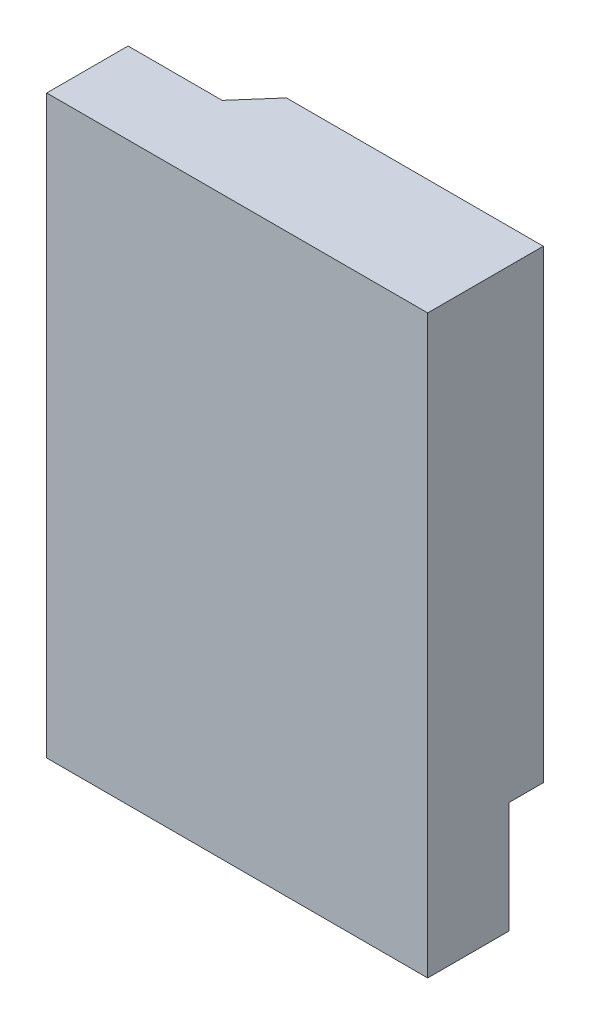
from build123d import *

# Parameters (mm, degrees)
SKETCH1_W           = 44.5
SKETCH1_H           = 67.274262182
BOSS_EXTRUDE1_DEPTH = 13.5
CUT_EXTRUDE1_DEPTH  = 73.5
CUT_EXTRUDE2_DEPTH  = 14
BOSS_EXTRUDE2_DEPTH = 14
CUT_EXTRUDE6_DEPTH  = 13
CUT_EXTRUDE8_DEPTH  = 2


with BuildPart() as part:
    # Sketch1 → Boss-Extrude1 (new body)
    with BuildSketch(Plane.XY):
        Rectangle(SKETCH1_W, SKETCH1_H)
    extrude(amount=BOSS_EXTRUDE1_DEPTH)

    # Sketch2 → Cut-Extrude1 (cut)
    with BuildSketch(Plane(origin=(0, 33.637131091, 0), x_dir=(1, 0, 0), z_dir=(0, 1, 0))):
        Polygon((-22.25, 0), (-7.75, 0), (-11.25, -4), (-22.25, -4), align=None)
    extrude(amount=-CUT_EXTRUDE1_DEPTH, mode=Mode.SUBTRACT)

    # Sketch3 → Cut-Extrude2 (cut)
    with BuildSketch(Plane.XZ.offset(33.637131091)):
        Polygon((22.25, 13.5), (8.05, 13.5), (12.5, 9.5), (22.25, 9.5), align=None)
    extrude(amount=-CUT_EXTRUDE2_DEPTH, mode=Mode.SUBTRACT)

    # Sketch6 → Boss-Extrude2 (add)
    with BuildSketch(Plane(origin=(0, -33.637131091, 0), x_dir=(-1, 0, 0), z_dir=(0, -1, 0))):
        Polygon((-22.25, -9.5), (-12.5, -9.5), (-8.05, -13.5), (-22.25, -13.5), align=None)
    extrude(amount=-BOSS_EXTRUDE2_DEPTH)

    # Sketch7 → Cut-Extrude6 (cut)
    with BuildSketch(Plane.XZ.offset(33.637131091)):
        Polygon((22.25, 0), (8.05, 0), (13.25, 4), (22.25, 4), align=None)
    extrude(amount=-CUT_EXTRUDE6_DEPTH, mode=Mode.SUBTRACT)

    # Sketch9 → Cut-Extrude8 (cut)
    # profile 1 of 10: a face of its own
    with BuildSketch(Plane(origin=(0, 0, 0), x_dir=(-1, 0, 0), z_dir=(0, 0, -1))):
        Polygon((-3.479095708, 31.090623678), (-2.896463496, 31.090623678), (-1.483001958, 27.590623678), (-2.153975515, 27.590623678), (-2.426010772, 28.308572396), (-3.950950676, 28.308572396), (-4.222985932, 27.590623678), (-4.893258368, 27.590623678), align=None)
        Polygon((-3.188130163, 30.151821595), (-3.712569265, 28.936777524), (-2.66369106, 28.936777524), align=None, mode=Mode.SUBTRACT)
    # profile 2 of 10: a face of its own
    with BuildSketch(Plane(origin=(0, 0, 0), x_dir=(-1, 0, 0), z_dir=(0, 0, -1))):
        with BuildLine():
            Line((-4.556719907, 24.391905729), (-3.824748753, 24.391905729))
            add(Edge.make_bspline(
                [(-3.824748753, 24.391905729), (-3.776365682, 24.391733997), (-3.683311409, 24.391403708), (-3.549132229, 24.386192618), (-3.4258702, 24.378940959), (-3.313342821, 24.367874735), (-3.211598233, 24.353202259), (-3.120534464, 24.335905839), (-3.040154176, 24.316192859), (-2.969779471, 24.291628931), (-2.906269781, 24.263921192), (-2.84706992, 24.232084493), (-2.790873851, 24.196473344), (-2.738057185, 24.15615072), (-2.688160932, 24.111842015), (-2.64109096, 24.063502628), (-2.597512411, 24.010722661), (-2.557695126, 23.953835616), (-2.521404875, 23.893991749), (-2.489331905, 23.831108895), (-2.463250113, 23.765143321), (-2.440204053, 23.697048375), (-2.423604723, 23.625850623), (-2.412060132, 23.55224319), (-2.403607634, 23.475966969), (-2.403121655, 23.424148291), (-2.402873753, 23.397715024)],
                knots=[0, 0, 0, 0, 1.749336639, 3.364467119, 4.854658419, 6.213483162, 7.451590619, 8.570285859, 9.5643256, 10.440900261, 11.26203566, 12.067320669, 12.869050712, 13.665104639, 14.467235401, 15.27997916, 16.102287765, 16.939272006, 17.78853747, 18.631303466, 19.488103222, 20.351255419, 21.228522269, 22.127379805, 23.044756219, 24, 24, 24, 24], degree=3))
            add(Edge.make_bspline(
                [(-2.402873753, 23.397715024), (-2.403517715, 23.370124765), (-2.404780407, 23.316025297), (-2.411581956, 23.23655759), (-2.42401305, 23.160528447), (-2.442841751, 23.088160471), (-2.464482896, 23.018552958), (-2.493260069, 22.952990211), (-2.525737952, 22.890518715), (-2.564310985, 22.832022153), (-2.606643005, 22.776201198), (-2.655874253, 22.72519456), (-2.708815301, 22.676260823), (-2.768442159, 22.632465033), (-2.832126418, 22.590845874), (-2.901133418, 22.553127833), (-2.975012797, 22.518362764), (-3.026953658, 22.49897536), (-3.053514778, 22.489061178)],
                knots=[0, 0, 0, 0, 1.099860209, 2.156625411, 3.176576793, 4.16617041, 5.135385252, 6.078461593, 7.016046972, 7.938469504, 8.868247731, 9.803980173, 10.76021508, 11.73834243, 12.748633912, 13.790971185, 14.870363756, 16, 16, 16, 16], degree=3))
            Line((-3.053514778, 22.489061178), (-2.245822471, 20.891905729))
            Line((-2.245822471, 20.891905729), (-2.944139778, 20.891905729))
            Line((-2.944139778, 20.891905729), (-3.715373753, 22.417546755))
            Line((-3.715373753, 22.417546755), (-3.928514778, 22.417546755))
            Line((-3.928514778, 22.417546755), (-3.928514778, 20.891905729))
            Line((-3.928514778, 20.891905729), (-4.556719907, 20.891905729))
            Line((-4.556719907, 20.891905729), (-4.556719907, 24.391905729))
        make_face()
        with BuildLine():
            Line((-3.928514778, 23.045751883), (-3.683823272, 23.045751883))
            add(Edge.make_bspline(
                [(-3.683823272, 23.045751883), (-3.653907701, 23.046088812), (-3.596625811, 23.046733959), (-3.514246931, 23.049726419), (-3.43942726, 23.056936769), (-3.3718455, 23.066046776), (-3.311161584, 23.076565595), (-3.257916792, 23.091639701), (-3.211290702, 23.107791988), (-3.171835836, 23.12786509), (-3.138126506, 23.15069256), (-3.109020656, 23.176625135), (-3.084945945, 23.206638787), (-3.06513123, 23.239917876), (-3.049717536, 23.276756748), (-3.03846672, 23.316750994), (-3.032179178, 23.360356201), (-3.031455775, 23.390449731), (-3.031078881, 23.406128486)],
                knots=[0, 0, 0, 0, 1.688639943, 3.233382647, 4.650958383, 5.928841754, 7.082724185, 8.122798841, 9.049171256, 9.863274652, 10.613301712, 11.341792392, 12.054588806, 12.776240173, 13.521029143, 14.301969904, 15.115324896, 16, 16, 16, 16], degree=3))
            add(Edge.make_bspline(
                [(-3.031078881, 23.406128486), (-3.031791433, 23.424677597), (-3.033191109, 23.461113888), (-3.047080247, 23.513569372), (-3.069188753, 23.562120511), (-3.099493461, 23.606547939), (-3.1376583, 23.64549609), (-3.181455463, 23.679829195), (-3.2318302, 23.706977245), (-3.278473416, 23.72488381), (-3.32090784, 23.735597493), (-3.359203569, 23.743581234), (-3.403550254, 23.749239541), (-3.453981373, 23.755241182), (-3.510368377, 23.759132943), (-3.573018609, 23.761973153), (-3.641752136, 23.763135222), (-3.689665933, 23.763506715), (-3.714672631, 23.763700601)],
                knots=[0, 0, 0, 0, 1.020303359, 2.004196876, 2.966617323, 3.9489082, 4.950758222, 5.960522915, 7.003732012, 8.091992268, 8.70421221, 9.413913587, 10.24622431, 11.166358409, 12.212345909, 13.359657661, 14.621978493, 16, 16, 16, 16], degree=3))
            Line((-3.714672631, 23.763700601), (-3.928514778, 23.763700601))
            Line((-3.928514778, 23.763700601), (-3.928514778, 23.045751883))
        make_face(mode=Mode.SUBTRACT)
    # profile 3 of 10: a face of its own
    with BuildSketch(Plane(origin=(0, 0, 0), x_dir=(-1, 0, 0), z_dir=(0, 0, -1))):
        with BuildLine():
            Line((-4.556719907, 17.69318778), (-3.7651534, 17.69318778))
            add(Edge.make_bspline(
                [(-3.7651534, 17.69318778), (-3.703441686, 17.692756394), (-3.584152246, 17.69192252), (-3.411325446, 17.682526766), (-3.250618515, 17.668076762), (-3.101927857, 17.648198163), (-2.965558313, 17.621893333), (-2.841685729, 17.588899079), (-2.729894358, 17.550812702), (-2.628958431, 17.505996351), (-2.536813637, 17.453744937), (-2.449319215, 17.395541056), (-2.366646958, 17.329252531), (-2.287636691, 17.256158199), (-2.213308058, 17.174920821), (-2.142423221, 17.086885984), (-2.076717763, 16.990777061), (-2.01420555, 16.88889844), (-1.957671572, 16.780818369), (-1.908360523, 16.667456805), (-1.867052359, 16.549543269), (-1.833487337, 16.426952099), (-1.80673214, 16.300090257), (-1.788012068, 16.168701751), (-1.776439133, 16.032908222), (-1.775265155, 15.940874281), (-1.774668624, 15.894109255)],
                knots=[0, 0, 0, 0, 1.44355588, 2.790409838, 4.047694926, 5.217575253, 6.298404546, 7.294384826, 8.214239204, 9.058592145, 9.873746385, 10.689560431, 11.514393297, 12.350027578, 13.205127629, 14.088021785, 14.991911688, 15.926770944, 16.882954281, 17.842803888, 18.816321264, 19.80318086, 20.814351908, 21.847355356, 22.906180909, 24, 24, 24, 24], degree=3))
            add(Edge.make_bspline(
                [(-1.774668624, 15.894109255), (-1.776230664, 15.828120759), (-1.779305631, 15.698218543), (-1.805207435, 15.507588538), (-1.847099422, 15.324850664), (-1.90600336, 15.15143437), (-1.979028475, 14.988883951), (-2.066265152, 14.840065917), (-2.166434299, 14.705779048), (-2.278368938, 14.586691982), (-2.399566891, 14.484335034), (-2.525516004, 14.3966738), (-2.65744325, 14.327545601), (-2.773689592, 14.283707986), (-2.874489673, 14.256444782), (-2.962991053, 14.240331966), (-3.063519591, 14.225555542), (-3.177012628, 14.214136639), (-3.302972294, 14.203953784), (-3.441900667, 14.198420817), (-3.593347936, 14.193823742), (-3.698542384, 14.193405322), (-3.75323433, 14.19318778)],
                knots=[0, 0, 0, 0, 1.315458931, 2.589557908, 3.828601765, 5.048913369, 6.235739168, 7.376350998, 8.481830359, 9.569842114, 10.627874879, 11.640079404, 12.624025415, 13.590060155, 14.111227486, 14.704434459, 15.382649715, 16.137166398, 16.978595427, 17.902333227, 18.909396075, 20, 20, 20, 20], degree=3))
            Line((-3.75323433, 14.19318778), (-4.556719907, 14.19318778))
            Line((-4.556719907, 14.19318778), (-4.556719907, 17.69318778))
        make_face()
        with BuildLine():
            Line((-3.928514778, 17.064982652), (-3.928514778, 14.821392909))
            Line((-3.928514778, 14.821392909), (-3.600389778, 14.821392909))
            add(Edge.make_bspline(
                [(-3.600389778, 14.821392909), (-3.561347943, 14.82146445), (-3.486257495, 14.821602046), (-3.377843887, 14.8281559), (-3.277588788, 14.834734162), (-3.185768178, 14.847219923), (-3.101713815, 14.861128182), (-3.026580385, 14.880483429), (-2.958819062, 14.900814477), (-2.899257538, 14.92669842), (-2.844704035, 14.955832521), (-2.794193722, 14.989966497), (-2.745437129, 15.027870991), (-2.699345798, 15.070660827), (-2.655745286, 15.117769387), (-2.614893561, 15.169439401), (-2.576245359, 15.225513222), (-2.540792709, 15.286287327), (-2.508395886, 15.351119926), (-2.479656275, 15.419383023), (-2.455826896, 15.491645101), (-2.436021375, 15.5672297), (-2.421868085, 15.64679487), (-2.410158937, 15.729751283), (-2.404122529, 15.816427606), (-2.40329407, 15.875405073), (-2.402873753, 15.905327204)],
                knots=[0, 0, 0, 0, 1.50275155, 2.890291501, 4.180787663, 5.369391935, 6.45668281, 7.458360028, 8.354766181, 9.177074746, 9.954075863, 10.732690366, 11.5210699, 12.329727389, 13.151100085, 13.990027547, 14.863562427, 15.770965086, 16.696477834, 17.652329173, 18.619756807, 19.62365428, 20.657822005, 21.729286259, 22.847956731, 24, 24, 24, 24], degree=3))
            add(Edge.make_bspline(
                [(-2.402873753, 15.905327204), (-2.403710883, 15.95118004), (-2.405343221, 16.040589519), (-2.42108514, 16.170816377), (-2.446709982, 16.293444472), (-2.483274161, 16.408018699), (-2.529364443, 16.514861072), (-2.587057175, 16.613066409), (-2.653869483, 16.704284426), (-2.706702834, 16.757795841), (-2.733102118, 16.784533934)],
                knots=[0, 0, 0, 0, 1.13821349, 2.219428113, 3.251817212, 4.244760574, 5.201143372, 6.134805572, 7.068016741, 8, 8, 8, 8], degree=3))
            add(Edge.make_bspline(
                [(-2.733102118, 16.784533934), (-2.759134312, 16.807318405), (-2.812302121, 16.853853105), (-2.905647322, 16.909613577), (-3.008508898, 16.958604618), (-3.123240015, 16.997449049), (-3.248731848, 17.028168881), (-3.385731827, 17.049355598), (-3.533506289, 17.062969958), (-3.635880993, 17.064297381), (-3.688731124, 17.064982652)],
                knots=[0, 0, 0, 0, 0.813307809, 1.661089106, 2.549956539, 3.493439533, 4.508053171, 5.589449661, 6.755572447, 8, 8, 8, 8], degree=3))
            Line((-3.688731124, 17.064982652), (-3.928514778, 17.064982652))
        make_face(mode=Mode.SUBTRACT)
    # profile 4 of 10: a face of its own
    with BuildSketch(Plane(origin=(0, 0, 0), x_dir=(-1, 0, 0), z_dir=(0, 0, -1))):
        with BuildLine():
            Line((-4.556719907, 10.994469832), (-3.928514778, 10.994469832))
            Line((-3.928514778, 10.994469832), (-3.928514778, 8.717226242))
            add(Edge.make_bspline(
                [(-3.928514778, 8.717226242), (-3.92848062, 8.693616768), (-3.928414642, 8.648015313), (-3.925111791, 8.582592156), (-3.922089454, 8.522454576), (-3.9166363, 8.467668412), (-3.908580124, 8.418210227), (-3.900779116, 8.37376232), (-3.890221223, 8.335120481), (-3.874354397, 8.291135951), (-3.849908829, 8.24171693), (-3.809966125, 8.190211292), (-3.763875663, 8.143204922), (-3.708633589, 8.1040786), (-3.646546383, 8.072428933), (-3.577955187, 8.048980031), (-3.50295669, 8.035945556), (-3.451099343, 8.033955604), (-3.424408208, 8.03293137)],
                knots=[0, 0, 0, 0, 1.155499968, 2.231836252, 3.205919964, 4.102923608, 4.924856345, 5.658536265, 6.31071849, 6.882491295, 7.94666036, 8.992281882, 10.060072772, 11.158554251, 12.289267114, 13.461410017, 14.693379945, 16, 16, 16, 16], degree=3))
            add(Edge.make_bspline(
                [(-3.424408208, 8.03293137), (-3.39605217, 8.03375882), (-3.340762698, 8.035372207), (-3.261237593, 8.051209345), (-3.187557133, 8.076427492), (-3.121281384, 8.112420216), (-3.0624763, 8.155563803), (-3.01269903, 8.204761012), (-2.97341499, 8.260109967), (-2.947811115, 8.311173592), (-2.9334358, 8.358173213), (-2.922660785, 8.400165591), (-2.914761507, 8.44971244), (-2.907595023, 8.50603998), (-2.903288517, 8.569731654), (-2.898618815, 8.640275248), (-2.896907325, 8.718153438), (-2.896615614, 8.772381483), (-2.896463496, 8.800659736)],
                knots=[0, 0, 0, 0, 1.261321664, 2.459363699, 3.594844139, 4.716940403, 5.803436589, 6.833651888, 7.818396249, 8.814403945, 9.360733334, 10.004355033, 10.743453831, 11.592799886, 12.532235708, 13.585170094, 14.740740724, 16, 16, 16, 16], degree=3))
            Line((-2.896463496, 8.800659736), (-2.896463496, 10.994469832))
            Line((-2.896463496, 10.994469832), (-2.268258368, 10.994469832))
            Line((-2.268258368, 10.994469832), (-2.268258368, 8.906529127))
            add(Edge.make_bspline(
                [(-2.268258368, 8.906529127), (-2.268345606, 8.864227548), (-2.268513355, 8.782885737), (-2.271089483, 8.665991831), (-2.276573594, 8.559227998), (-2.281179614, 8.462563043), (-2.29009384, 8.376127189), (-2.299380373, 8.29955133), (-2.311216858, 8.233106834), (-2.328828836, 8.15746785), (-2.359221896, 8.070372329), (-2.408219493, 7.970085614), (-2.470418772, 7.871898844), (-2.54393521, 7.776892143), (-2.626941994, 7.68863398), (-2.717598685, 7.611154737), (-2.814464974, 7.545615651), (-2.918553044, 7.493619234), (-3.029774311, 7.453065949), (-3.149229226, 7.425816183), (-3.276836331, 7.4074059), (-3.36497697, 7.405637366), (-3.410385772, 7.404726242)],
                knots=[0, 0, 0, 0, 1.170808336, 2.251350247, 3.235597562, 4.129743112, 4.929140599, 5.639994148, 6.264258765, 6.79612947, 7.788252245, 8.809469599, 9.879094798, 10.999557536, 12.129761673, 13.226370002, 14.293821979, 15.358369427, 16.438775801, 17.562147481, 18.744053101, 20, 20, 20, 20], degree=3))
            add(Edge.make_bspline(
                [(-3.410385772, 7.404726242), (-3.440556283, 7.405234424), (-3.500082083, 7.406237058), (-3.587625215, 7.415077666), (-3.672252848, 7.428105399), (-3.753805969, 7.447111519), (-3.832567633, 7.471663876), (-3.908516914, 7.501886118), (-3.981371567, 7.537609669), (-4.050723907, 7.57850595), (-4.116488591, 7.622728237), (-4.176594117, 7.671750503), (-4.233108858, 7.721947368), (-4.284400127, 7.775431328), (-4.330853166, 7.831640892), (-4.372372305, 7.890703451), (-4.408895861, 7.952613758), (-4.441342564, 8.018487741), (-4.469113775, 8.09167354), (-4.49252595, 8.174774401), (-4.512979376, 8.269092849), (-4.528179156, 8.374841377), (-4.541959365, 8.491671451), (-4.550681478, 8.619887431), (-4.555244408, 8.759492994), (-4.556215646, 8.856278637), (-4.556719907, 8.906529127)],
                knots=[0, 0, 0, 0, 1.001158378, 1.975264943, 2.917723546, 3.841610987, 4.75185031, 5.653588123, 6.552117133, 7.442167995, 8.324307438, 9.179605724, 10.014504199, 10.831958861, 11.636465792, 12.43274043, 13.225645099, 14.020104002, 14.867201867, 15.819789774, 16.883317127, 18.068162734, 19.364263498, 20.787406516, 22.332041935, 24, 24, 24, 24], degree=3))
            Line((-4.556719907, 8.906529127), (-4.556719907, 10.994469832))
        make_face()
    # profile 5 of 10: a face of its own
    with BuildSketch(Plane(origin=(0, 0, 0), x_dir=(-1, 0, 0), z_dir=(0, 0, -1))):
        with BuildLine():
            Line((-1.415694265, 3.688580409), (-1.876331285, 3.248275922))
            add(Edge.make_bspline(
                [(-1.876331285, 3.248275922), (-1.915406269, 3.288679521), (-1.991731956, 3.367600409), (-2.114721361, 3.47208471), (-2.242625864, 3.559158238), (-2.372957339, 3.632491008), (-2.50806007, 3.687972476), (-2.646371902, 3.728402755), (-2.788775997, 3.753051569), (-2.885149612, 3.755871829), (-2.933622951, 3.757290345)],
                knots=[0, 0, 0, 0, 1.115251505, 2.178435587, 3.19620269, 4.182487026, 5.141301733, 6.088180966, 7.038406374, 8, 8, 8, 8], degree=3))
            add(Edge.make_bspline(
                [(-2.933622951, 3.757290345), (-2.974104081, 3.756169668), (-3.053989129, 3.753958136), (-3.171281314, 3.737745426), (-3.283477351, 3.710175007), (-3.390961304, 3.672177862), (-3.493416898, 3.623011573), (-3.591058942, 3.562714194), (-3.683646706, 3.491830296), (-3.769957158, 3.410726635), (-3.848910926, 3.322114791), (-3.918671608, 3.227566164), (-3.977107369, 3.127297361), (-4.025064647, 3.02232383), (-4.062421513, 2.912159701), (-4.089099009, 2.796879143), (-4.10452856, 2.676344863), (-4.106831524, 2.594406558), (-4.108001958, 2.552763101)],
                knots=[0, 0, 0, 0, 1.035432265, 2.043311493, 3.022114605, 3.98653278, 4.95457646, 5.923598177, 6.917315552, 7.932509744, 8.948865224, 9.949768934, 10.933144597, 11.912367597, 12.897413939, 13.903909035, 14.934704909, 16, 16, 16, 16], degree=3))
            add(Edge.make_bspline(
                [(-4.108001958, 2.552763101), (-4.107664652, 2.523534809), (-4.106999816, 2.465925245), (-4.099722004, 2.380704712), (-4.088003012, 2.298020647), (-4.071042727, 2.217998295), (-4.049833723, 2.140568309), (-4.024950733, 2.065062703), (-3.993735387, 1.992524795), (-3.959085883, 1.922112104), (-3.918788908, 1.85574593), (-3.875341336, 1.792460274), (-3.828229538, 1.732565358), (-3.777148367, 1.676306033), (-3.72137892, 1.624561507), (-3.662362631, 1.57577576), (-3.599103977, 1.531170065), (-3.532916999, 1.489624993), (-3.463229927, 1.453534435), (-3.391933532, 1.420843362), (-3.317946818, 1.39429335), (-3.242170616, 1.372891618), (-3.164875724, 1.354692642), (-3.085306127, 1.343486973), (-3.004151593, 1.335001051), (-2.94930475, 1.334477095), (-2.921703881, 1.334213422)],
                knots=[0, 0, 0, 0, 1.103660481, 2.175337485, 3.227646561, 4.255952547, 5.262355991, 6.258840057, 7.255597736, 8.242457506, 9.22035537, 10.185017736, 11.140346927, 12.096287581, 13.051739095, 14.01125915, 14.986044842, 15.97314143, 16.960198552, 17.947847494, 18.933482797, 19.925264591, 20.920966487, 21.929612487, 22.958107872, 24, 24, 24, 24], degree=3))
            add(Edge.make_bspline(
                [(-2.921703881, 1.334213422), (-2.874888064, 1.335567583), (-2.782907158, 1.338228159), (-2.647911952, 1.359033486), (-2.51927497, 1.393257072), (-2.416494636, 1.433673138), (-2.33596896, 1.473584528), (-2.274665953, 1.510500598), (-2.211273866, 1.551795276), (-2.146845587, 1.599027067), (-2.080656426, 1.65162917), (-2.013874774, 1.710753671), (-1.944791009, 1.774453685), (-1.89953492, 1.819917635), (-1.876331285, 1.843227845)],
                knots=[0, 0, 0, 0, 1.404581149, 2.759636711, 4.088442092, 5.392261763, 6.066678138, 6.783632037, 7.538459478, 8.336747902, 9.180226004, 10.074962426, 11.012997595, 12, 12, 12, 12], degree=3))
            Line((-1.876331285, 1.843227845), (-1.429716701, 1.374177364))
            add(Edge.make_bspline(
                [(-1.429716701, 1.374177364), (-1.461111303, 1.343866862), (-1.52238685, 1.284707244), (-1.614819313, 1.200706108), (-1.707135446, 1.125221748), (-1.797105083, 1.055514415), (-1.886202022, 0.993614852), (-1.974416813, 0.939461238), (-2.060750827, 0.891683951), (-2.146996816, 0.851088732), (-2.233691449, 0.816619174), (-2.322890038, 0.786943148), (-2.414865272, 0.761838297), (-2.510178893, 0.741581979), (-2.607941875, 0.725339147), (-2.709069149, 0.71437533), (-2.812919517, 0.70700472), (-2.883362831, 0.706342409), (-2.918899394, 0.706008293)],
                knots=[0, 0, 0, 0, 1.244526981, 2.429050516, 3.560637417, 4.644440555, 5.67424972, 6.652764056, 7.595344123, 8.486817594, 9.369275933, 10.254498637, 11.166417451, 12.086725134, 13.032340136, 13.991389299, 14.986715468, 16, 16, 16, 16], degree=3))
            add(Edge.make_bspline(
                [(-2.918899394, 0.706008293), (-2.984175658, 0.707672315), (-3.111903162, 0.710928344), (-3.299084488, 0.735053313), (-3.476901724, 0.775498398), (-3.645787465, 0.832698905), (-3.805688009, 0.905769871), (-3.956562449, 0.995351444), (-4.098167609, 1.10120562), (-4.229359599, 1.222091686), (-4.348028996, 1.355600197), (-4.452919001, 1.498951711), (-4.539684018, 1.652850749), (-4.61172688, 1.815023729), (-4.668063451, 1.986210711), (-4.707714846, 2.166596865), (-4.732167573, 2.35600802), (-4.734842736, 2.485380204), (-4.736207086, 2.551360857)],
                knots=[0, 0, 0, 0, 1.078019885, 2.10938526, 3.111377082, 4.085535484, 5.04941344, 6.010039228, 6.978205633, 7.964457913, 8.951525778, 9.924444315, 10.892603023, 11.863865945, 12.85144698, 13.863884204, 14.910567087, 16, 16, 16, 16], degree=3))
            add(Edge.make_bspline(
                [(-4.736207086, 2.551360857), (-4.735630578, 2.594392877), (-4.734488079, 2.679671821), (-4.722480312, 2.805294616), (-4.705740786, 2.92775437), (-4.67918505, 3.045779546), (-4.64717473, 3.16096016), (-4.607365691, 3.272044334), (-4.559821513, 3.379351334), (-4.506074659, 3.4830608), (-4.44527138, 3.582493323), (-4.377347443, 3.67679462), (-4.304051474, 3.766692682), (-4.223622291, 3.850994842), (-4.137228635, 3.93044129), (-4.044480449, 4.004601491), (-3.945935566, 4.074538986), (-3.841327263, 4.138450256), (-3.7326878, 4.196261397), (-3.621387406, 4.247253293), (-3.507699534, 4.289870774), (-3.392104866, 4.325220404), (-3.274115016, 4.351606402), (-3.154572166, 4.371579752), (-3.03245915, 4.382744982), (-2.950470838, 4.384572802), (-2.909083689, 4.385495473)],
                knots=[0, 0, 0, 0, 1.071919942, 2.124283339, 3.142214191, 4.149696895, 5.136002878, 6.119640489, 7.086990633, 8.058538607, 9.028339693, 9.988281803, 10.952401235, 11.916291999, 12.888973767, 13.874849856, 14.873389453, 15.898127285, 16.927174885, 17.938320013, 18.946391617, 19.950418109, 20.947802303, 21.956882652, 22.968648068, 24, 24, 24, 24], degree=3))
            add(Edge.make_bspline(
                [(-2.909083689, 4.385495473), (-2.873776206, 4.384966575), (-2.803528341, 4.383914278), (-2.698917482, 4.375142237), (-2.595143252, 4.361365836), (-2.492577194, 4.340580181), (-2.390485651, 4.315904982), (-2.29021022, 4.283596212), (-2.190169002, 4.247582), (-2.091930996, 4.204534362), (-1.995359074, 4.157543978), (-1.902715587, 4.10423168), (-1.812445059, 4.047878248), (-1.726547831, 3.985148439), (-1.643414862, 3.91831758), (-1.563480862, 3.847073868), (-1.4874473, 3.770229459), (-1.439732857, 3.715934349), (-1.415694265, 3.688580409)],
                knots=[0, 0, 0, 0, 0.996412454, 1.982464992, 2.961075852, 3.949442424, 4.934965278, 5.923860011, 6.921385422, 7.934793307, 8.949617135, 9.951082467, 10.950285876, 11.951772932, 12.951063433, 13.960125323, 14.972308753, 16, 16, 16, 16], degree=3))
        make_face()
    # profile 6 of 10: a face of its own
    with BuildSketch(Plane(origin=(0, 0, 0), x_dir=(-1, 0, 0), z_dir=(0, 0, -1))):
        with BuildLine():
            add(Edge.make_bspline(
                [(-2.911888176, -2.313222476), (-2.851036386, -2.314798038), (-2.730901171, -2.317908554), (-2.554225622, -2.343837131), (-2.383966063, -2.38608403), (-2.220199486, -2.444810276), (-2.063335942, -2.521606474), (-1.912822122, -2.614295401), (-1.76919716, -2.724626504), (-1.633932807, -2.850025943), (-1.50892415, -2.986392356), (-1.400604076, -3.133215044), (-1.30823269, -3.286689684), (-1.231675039, -3.447227514), (-1.173362138, -3.615940337), (-1.132441563, -3.791967939), (-1.106152121, -3.975260243), (-1.10312843, -4.100057319), (-1.101591701, -4.163482893)],
                knots=[0, 0, 0, 0, 1.014329547, 2.002516266, 2.970391464, 3.935626869, 4.897733899, 5.877609409, 6.878433252, 7.912639331, 8.949961323, 9.958554974, 10.949718813, 11.932905612, 12.9188844, 13.919928257, 14.942845884, 16, 16, 16, 16], degree=3))
            add(Edge.make_bspline(
                [(-1.101591701, -4.163482893), (-1.103228251, -4.226193806), (-1.106453125, -4.349767673), (-1.131368313, -4.531370866), (-1.172977995, -4.705512846), (-1.230301864, -4.872587788), (-1.305471049, -5.031786436), (-1.396041092, -5.184125254), (-1.504401964, -5.328190499), (-1.626601318, -5.463904862), (-1.761132203, -5.587094767), (-1.903621766, -5.695655659), (-2.053412079, -5.787646061), (-2.210283897, -5.863023839), (-2.374573623, -5.921521756), (-2.545875443, -5.962796287), (-2.724178756, -5.987879653), (-2.845433655, -5.991083463), (-2.906980323, -5.992709655)],
                knots=[0, 0, 0, 0, 1.051557043, 2.072126891, 3.067553643, 4.050577992, 5.02905126, 6.015227836, 7.017913613, 8.04756643, 9.074058332, 10.072836633, 11.047628519, 12.017157415, 12.98668631, 13.966869689, 14.968021931, 16, 16, 16, 16], degree=3))
            add(Edge.make_bspline(
                [(-2.906980323, -5.992709655), (-2.971350758, -5.991250881), (-3.097829865, -5.988384587), (-3.282932604, -5.961127448), (-3.460277022, -5.920068675), (-3.628373324, -5.858790658), (-3.788933427, -5.782187984), (-3.940777649, -5.687847199), (-4.08385496, -5.575924208), (-4.217344646, -5.4492854), (-4.338286624, -5.310714768), (-4.445041643, -5.164327183), (-4.535091869, -5.011240919), (-4.608440598, -4.851384327), (-4.66626579, -4.685750877), (-4.707054892, -4.513331813), (-4.731149989, -4.33454066), (-4.734506296, -4.213102135), (-4.736207086, -4.151563822)],
                knots=[0, 0, 0, 0, 1.067978421, 2.098431617, 3.099715153, 4.085208694, 5.062210972, 6.048429807, 7.046490867, 8.072918869, 9.098532598, 10.095778865, 11.076610158, 12.041847152, 13.011192615, 13.984257998, 14.978533688, 16, 16, 16, 16], degree=3))
            add(Edge.make_bspline(
                [(-4.736207086, -4.151563822), (-4.73567328, -4.110164067), (-4.734612427, -4.027888771), (-4.721833338, -3.905960984), (-4.703435124, -3.786413063), (-4.676225038, -3.669721648), (-4.643171739, -3.555063535), (-4.60034652, -3.443505991), (-4.551599831, -3.333857274), (-4.494643916, -3.227412473), (-4.431314444, -3.125150968), (-4.362216353, -3.027555146), (-4.287175895, -2.935805082), (-4.206434801, -2.849297833), (-4.119714825, -2.768602017), (-4.028156681, -2.692575273), (-3.929984672, -2.623237141), (-3.827347476, -2.558894246), (-3.720823738, -2.500710081), (-3.610847106, -2.45118546), (-3.499683316, -2.407936453), (-3.38584737, -2.373802424), (-3.270559222, -2.346000614), (-3.152587252, -2.3276148), (-3.03299727, -2.314836065), (-2.952353679, -2.313761615), (-2.911888176, -2.313222476)],
                knots=[0, 0, 0, 0, 1.034744296, 2.056386356, 3.06226378, 4.057406941, 5.050368692, 6.043467995, 7.042652155, 8.049140477, 9.059438543, 10.048523776, 11.036952808, 12.020949711, 13.004946614, 13.997082645, 14.994316842, 16.007702937, 17.024872941, 18.026463647, 19.021641123, 20.005082605, 20.995858141, 21.984425357, 22.988620895, 24, 24, 24, 24], degree=3))
        make_face()
        with BuildLine():
            add(Edge.make_bspline(
                [(-2.921703881, -2.941427604), (-2.962657127, -2.942526472), (-3.043482447, -2.944695196), (-3.162038472, -2.961217946), (-3.275856443, -2.987606656), (-3.384305422, -3.025830379), (-3.487855435, -3.074479478), (-3.586690046, -3.133383965), (-3.6794406, -3.204568619), (-3.767343834, -3.28421185), (-3.846749941, -3.372952714), (-3.916907742, -3.468053641), (-3.975618521, -3.569355814), (-4.024789167, -3.675918162), (-4.061803765, -3.788938948), (-4.088168154, -3.907532868), (-4.104829463, -4.031904267), (-4.106929642, -4.116688088), (-4.108001958, -4.159977284)],
                knots=[0, 0, 0, 0, 1.033739768, 2.040188636, 3.016340934, 3.979330865, 4.937572243, 5.900995986, 6.878200029, 7.884839167, 8.891893314, 9.879764717, 10.863503415, 11.843163062, 12.837761627, 13.859916423, 14.907309254, 16, 16, 16, 16], degree=3))
            add(Edge.make_bspline(
                [(-4.108001958, -4.159977284), (-4.10658023, -4.20795145), (-4.10379388, -4.301972867), (-4.084188783, -4.439128777), (-4.050646413, -4.568658922), (-4.002211883, -4.689929788), (-3.942140359, -4.804287998), (-3.867541059, -4.910331929), (-3.779622141, -5.008696524), (-3.711890118, -5.066125871), (-3.677513176, -5.095273758)],
                knots=[0, 0, 0, 0, 1.078454662, 2.113592447, 3.107694534, 4.079536787, 5.043276885, 6.005368276, 6.987637804, 8, 8, 8, 8], degree=3))
            add(Edge.make_bspline(
                [(-3.677513176, -5.095273758), (-3.649351897, -5.116807097), (-3.593663819, -5.159388627), (-3.504773521, -5.213965591), (-3.413234017, -5.260743495), (-3.318354528, -5.298539487), (-3.220335433, -5.32826918), (-3.119190175, -5.349088394), (-3.015062066, -5.362154252), (-2.94464576, -5.36371587), (-2.909083689, -5.364504527)],
                knots=[0, 0, 0, 0, 1.023928204, 2.024787132, 3.009472467, 3.9914905, 4.972207045, 5.96565515, 6.972602802, 8, 8, 8, 8], degree=3))
            add(Edge.make_bspline(
                [(-2.909083689, -5.364504527), (-2.868834634, -5.363396342), (-2.789643354, -5.361215954), (-2.673294314, -5.344896608), (-2.561828399, -5.317278383), (-2.45455362, -5.279389972), (-2.35177931, -5.230130042), (-2.254007755, -5.169398522), (-2.161067534, -5.097941116), (-2.073276288, -5.017251994), (-1.993030938, -4.928161553), (-1.923019542, -4.832553368), (-1.862442053, -4.732533972), (-1.814293912, -4.626687744), (-1.775816951, -4.516013821), (-1.749769871, -4.400022053), (-1.732967812, -4.279190603), (-1.730867041, -4.19696053), (-1.72979683, -4.155069431)],
                knots=[0, 0, 0, 0, 1.026359118, 2.019393844, 2.989460624, 3.950973911, 4.916101784, 5.890408035, 6.881132271, 7.902007068, 8.92769091, 9.933912415, 10.920395702, 11.90457117, 12.894218921, 13.903490204, 14.931958862, 16, 16, 16, 16], degree=3))
            add(Edge.make_bspline(
                [(-1.72979683, -4.155069431), (-1.730904071, -4.113419217), (-1.733083506, -4.031437123), (-1.749431575, -3.910916329), (-1.776874652, -3.795436631), (-1.814876838, -3.684809438), (-1.863403618, -3.578926295), (-1.923411903, -3.478159549), (-1.994691133, -3.382606617), (-2.075600821, -3.292918656), (-2.163666043, -3.210501164), (-2.258212859, -3.138977764), (-2.356595741, -3.076826203), (-2.461072075, -3.028139179), (-2.56950436, -2.989350331), (-2.682554257, -2.960785667), (-2.80064995, -2.94481127), (-2.880992891, -2.942565546), (-2.921703881, -2.941427604)],
                knots=[0, 0, 0, 0, 1.055025985, 2.07665775, 3.074803781, 4.057872707, 5.035505728, 6.020516407, 7.023567878, 8.050795229, 9.077271434, 10.074415901, 11.050397877, 12.019801805, 12.988065821, 13.964604439, 14.968634123, 16, 16, 16, 16], degree=3))
        make_face(mode=Mode.SUBTRACT)
    # profile 7 of 10: a face of its own
    with BuildSketch(Plane(origin=(0, 0, 0), x_dir=(-1, 0, 0), z_dir=(0, 0, -1))):
        with BuildLine():
            Line((-4.556719907, -9.101684014), (-3.855598112, -9.101684014))
            add(Edge.make_bspline(
                [(-3.855598112, -9.101684014), (-3.809787723, -9.101889071), (-3.721409881, -9.102284669), (-3.593961762, -9.107081822), (-3.476384632, -9.115678611), (-3.368705504, -9.126302883), (-3.270968653, -9.141197699), (-3.183051684, -9.158273439), (-3.104936351, -9.17907666), (-3.035741788, -9.203769796), (-2.973641902, -9.232882038), (-2.914875382, -9.263888653), (-2.860770356, -9.300893955), (-2.80859598, -9.33990967), (-2.761335154, -9.384662953), (-2.716039465, -9.432175408), (-2.674627307, -9.484331341), (-2.636906794, -9.540499418), (-2.602688475, -9.599641892), (-2.572793063, -9.661864494), (-2.548543579, -9.727265684), (-2.528201278, -9.795422391), (-2.511862143, -9.866331644), (-2.500986294, -9.940429541), (-2.493598871, -10.017198703), (-2.492947033, -10.069447843), (-2.492617342, -10.09587472)],
                knots=[0, 0, 0, 0, 1.698747864, 3.27724071, 4.728299578, 6.070144658, 7.288476769, 8.393259625, 9.389771311, 10.283485332, 11.113357557, 11.931608583, 12.74405601, 13.541433047, 14.344816069, 15.154114104, 15.974336324, 16.810834471, 17.661136416, 18.50621059, 19.367396281, 20.244825668, 21.142564693, 22.063065223, 23.020325768, 24, 24, 24, 24], degree=3))
            add(Edge.make_bspline(
                [(-2.492617342, -10.09587472), (-2.493094363, -10.125110144), (-2.494031768, -10.182561345), (-2.503221354, -10.266777758), (-2.518920071, -10.347070482), (-2.539437473, -10.424116642), (-2.568047531, -10.496648656), (-2.600733178, -10.566397161), (-2.640946892, -10.631406624), (-2.686897489, -10.692490233), (-2.737080783, -10.750144627), (-2.792688123, -10.802705146), (-2.85265961, -10.850530092), (-2.91664809, -10.894120674), (-2.984893795, -10.93338896), (-3.057347483, -10.968702657), (-3.134503908, -10.998932323), (-3.188233321, -11.014742193), (-3.215473913, -11.022757732)],
                knots=[0, 0, 0, 0, 1.102006807, 2.165578795, 3.188629044, 4.184801286, 5.166646146, 6.124351954, 7.085497154, 8.042432466, 9.003981491, 9.963833307, 10.922997304, 11.89326795, 12.880200226, 13.889073926, 14.929769137, 16, 16, 16, 16], degree=3))
            add(Edge.make_bspline(
                [(-3.215473913, -11.022757732), (-3.233416134, -11.027221786), (-3.272284762, -11.036892364), (-3.336601666, -11.046710427), (-3.410720145, -11.055737533), (-3.494879872, -11.063495237), (-3.589129368, -11.068768669), (-3.693377374, -11.072886984), (-3.807671133, -11.075881425), (-3.887146494, -11.075987681), (-3.928514778, -11.076042989)],
                knots=[0, 0, 0, 0, 0.618981996, 1.340914327, 2.176866532, 3.120127938, 4.170906482, 5.338178032, 6.614476169, 8, 8, 8, 8], degree=3))
            Line((-3.928514778, -11.076042989), (-3.928514778, -12.601684014))
            Line((-3.928514778, -12.601684014), (-4.556719907, -12.601684014))
            Line((-4.556719907, -12.601684014), (-4.556719907, -9.101684014))
        make_face()
        with BuildLine():
            Line((-3.928514778, -10.447837861), (-3.706259169, -10.447837861))
            add(Edge.make_bspline(
                [(-3.706259169, -10.447837861), (-3.665816252, -10.447581421), (-3.591400684, -10.447109569), (-3.489775297, -10.440286308), (-3.408107181, -10.42986581), (-3.343587852, -10.414920407), (-3.292643732, -10.392238778), (-3.248707617, -10.366000405), (-3.21102249, -10.332822702), (-3.178392716, -10.2949115), (-3.152306196, -10.251349629), (-3.134216552, -10.202846409), (-3.122465876, -10.150420945), (-3.121380592, -10.113936292), (-3.120822471, -10.095173598)],
                knots=[0, 0, 0, 0, 1.8619151, 3.425951444, 4.686033666, 5.651700536, 6.461346321, 7.243864085, 7.999046032, 8.762387399, 9.539336099, 10.322741239, 11.137448474, 12, 12, 12, 12], degree=3))
            add(Edge.make_bspline(
                [(-3.120822471, -10.095173598), (-3.121374851, -10.078780876), (-3.122446601, -10.046975055), (-3.130319969, -10.001071366), (-3.142867853, -9.958279658), (-3.161049254, -9.919046834), (-3.184553501, -9.883439558), (-3.213209934, -9.851471855), (-3.246650835, -9.822459111), (-3.272469166, -9.807102222), (-3.285586092, -9.7993002)],
                knots=[0, 0, 0, 0, 1.102301479, 2.1387299, 3.123554645, 4.094223062, 5.036071848, 5.982632524, 6.975082478, 8, 8, 8, 8], degree=3))
            add(Edge.make_bspline(
                [(-3.285586092, -9.7993002), (-3.296696886, -9.793681153), (-3.320220713, -9.78178448), (-3.36028407, -9.767953727), (-3.406516573, -9.756285963), (-3.459230342, -9.746601832), (-3.518215088, -9.73908594), (-3.583460287, -9.733338163), (-3.655061952, -9.731026758), (-3.704856626, -9.730278807), (-3.730798432, -9.729889143)],
                knots=[0, 0, 0, 0, 0.656809284, 1.390599849, 2.23162475, 3.173112763, 4.218524733, 5.370385145, 6.63003504, 8, 8, 8, 8], degree=3))
            Line((-3.730798432, -9.729889143), (-3.928514778, -9.729889143))
            Line((-3.928514778, -9.729889143), (-3.928514778, -10.447837861))
        make_face(mode=Mode.SUBTRACT)
    # profile 8 of 10: a face of its own
    with BuildSketch(Plane(origin=(0, 0, 0), x_dir=(-1, 0, 0), z_dir=(0, 0, -1))):
        Polygon((-4.915694265, -15.800401963), (-3.031078881, -15.800401963), (-3.031078881, -16.428607091), (-3.659284009, -16.428607091), (-3.659284009, -19.300401963), (-4.287489137, -19.300401963), (-4.287489137, -16.428607091), (-4.915694265, -16.428607091), align=None)
    # profile 9 of 10: a face of its own
    with BuildSketch(Plane(origin=(0, 0, 0), x_dir=(-1, 0, 0), z_dir=(0, 0, -1))):
        Polygon((-4.556719907, -22.499119912), (-2.672104522, -22.499119912), (-2.672104522, -23.12732504), (-3.928514778, -23.12732504), (-3.928514778, -23.800401963), (-2.672104522, -23.800401963), (-2.672104522, -24.428607091), (-3.928514778, -24.428607091), (-3.928514778, -25.370914784), (-2.672104522, -25.370914784), (-2.672104522, -25.999119912), (-4.556719907, -25.999119912), align=None)
    # profile 10 of 10: a face of its own
    with BuildSketch(Plane(origin=(0, 0, 0), x_dir=(-1, 0, 0), z_dir=(0, 0, -1))):
        with BuildLine():
            Line((-4.556719907, -29.197837861), (-3.824748753, -29.197837861))
            add(Edge.make_bspline(
                [(-3.824748753, -29.197837861), (-3.776365682, -29.198009593), (-3.683311409, -29.198339882), (-3.549132229, -29.203550972), (-3.4258702, -29.210802631), (-3.313342821, -29.221868855), (-3.211598233, -29.23654133), (-3.120534464, -29.253837751), (-3.040154176, -29.273550731), (-2.969779471, -29.298114659), (-2.906269781, -29.325822397), (-2.84706992, -29.357659097), (-2.790873851, -29.393270246), (-2.738057185, -29.43359287), (-2.688160932, -29.477901574), (-2.64109096, -29.526240961), (-2.597512411, -29.579020929), (-2.557695126, -29.635907974), (-2.521404875, -29.69575184), (-2.489331905, -29.758634695), (-2.463250113, -29.824600268), (-2.440204053, -29.892695215), (-2.423604723, -29.963892966), (-2.412060132, -30.037500399), (-2.403607634, -30.113776621), (-2.403121655, -30.165595299), (-2.402873753, -30.192028566)],
                knots=[0, 0, 0, 0, 1.749336639, 3.364467119, 4.854658419, 6.213483162, 7.451590619, 8.570285859, 9.5643256, 10.440900261, 11.26203566, 12.067320669, 12.869050712, 13.665104639, 14.467235401, 15.27997916, 16.102287765, 16.939272006, 17.78853747, 18.631303466, 19.488103222, 20.351255419, 21.228522269, 22.127379805, 23.044756219, 24, 24, 24, 24], degree=3))
            add(Edge.make_bspline(
                [(-2.402873753, -30.192028566), (-2.403517715, -30.219618824), (-2.404780407, -30.273718293), (-2.411581956, -30.353186), (-2.42401305, -30.429215143), (-2.442841751, -30.501583119), (-2.464482896, -30.571190632), (-2.493260069, -30.636753378), (-2.525737952, -30.699224874), (-2.564310985, -30.757721437), (-2.606643005, -30.813542391), (-2.655874253, -30.86454903), (-2.708815301, -30.913482766), (-2.768442159, -30.957278557), (-2.832126418, -30.998897716), (-2.901133418, -31.036615757), (-2.975012797, -31.071380826), (-3.026953658, -31.09076823), (-3.053514778, -31.100682412)],
                knots=[0, 0, 0, 0, 1.099860209, 2.156625411, 3.176576793, 4.16617041, 5.135385252, 6.078461593, 7.016046972, 7.938469504, 8.868247731, 9.803980173, 10.76021508, 11.73834243, 12.748633912, 13.790971185, 14.870363756, 16, 16, 16, 16], degree=3))
            Line((-3.053514778, -31.100682412), (-2.245822471, -32.697837861))
            Line((-2.245822471, -32.697837861), (-2.944139778, -32.697837861))
            Line((-2.944139778, -32.697837861), (-3.715373753, -31.172196835))
            Line((-3.715373753, -31.172196835), (-3.928514778, -31.172196835))
            Line((-3.928514778, -31.172196835), (-3.928514778, -32.697837861))
            Line((-3.928514778, -32.697837861), (-4.556719907, -32.697837861))
            Line((-4.556719907, -32.697837861), (-4.556719907, -29.197837861))
        make_face()
        with BuildLine():
            Line((-3.928514778, -30.543991707), (-3.683823272, -30.543991707))
            add(Edge.make_bspline(
                [(-3.683823272, -30.543991707), (-3.653907701, -30.543654777), (-3.596625811, -30.54300963), (-3.514246931, -30.54001717), (-3.43942726, -30.532806821), (-3.3718455, -30.523696814), (-3.311161584, -30.513177995), (-3.257916792, -30.498103888), (-3.211290702, -30.481951602), (-3.171835836, -30.4618785), (-3.138126506, -30.439051029), (-3.109020656, -30.413118455), (-3.084945945, -30.383104803), (-3.06513123, -30.349825713), (-3.049717536, -30.312986842), (-3.03846672, -30.272992596), (-3.032179178, -30.229387389), (-3.031455775, -30.199293859), (-3.031078881, -30.183615104)],
                knots=[0, 0, 0, 0, 1.688639943, 3.233382647, 4.650958383, 5.928841754, 7.082724185, 8.122798841, 9.049171256, 9.863274652, 10.613301712, 11.341792392, 12.054588806, 12.776240173, 13.521029143, 14.301969904, 15.115324896, 16, 16, 16, 16], degree=3))
            add(Edge.make_bspline(
                [(-3.031078881, -30.183615104), (-3.031791433, -30.165065993), (-3.033191109, -30.128629702), (-3.047080247, -30.076174218), (-3.069188753, -30.027623079), (-3.099493461, -29.983195651), (-3.1376583, -29.9442475), (-3.181455463, -29.909914395), (-3.2318302, -29.882766345), (-3.278473416, -29.86485978), (-3.32090784, -29.854146097), (-3.359203569, -29.846162356), (-3.403550254, -29.840504049), (-3.453981373, -29.834502407), (-3.510368377, -29.830610647), (-3.573018609, -29.827770437), (-3.641752136, -29.826608368), (-3.689665933, -29.826236875), (-3.714672631, -29.826042989)],
                knots=[0, 0, 0, 0, 1.020303359, 2.004196876, 2.966617323, 3.9489082, 4.950758222, 5.960522915, 7.003732012, 8.091992268, 8.70421221, 9.413913587, 10.24622431, 11.166358409, 12.212345909, 13.359657661, 14.621978493, 16, 16, 16, 16], degree=3))
            Line((-3.714672631, -29.826042989), (-3.928514778, -29.826042989))
            Line((-3.928514778, -29.826042989), (-3.928514778, -30.543991707))
        make_face(mode=Mode.SUBTRACT)
    extrude(amount=-CUT_EXTRUDE8_DEPTH, mode=Mode.SUBTRACT)


solid = part.part
